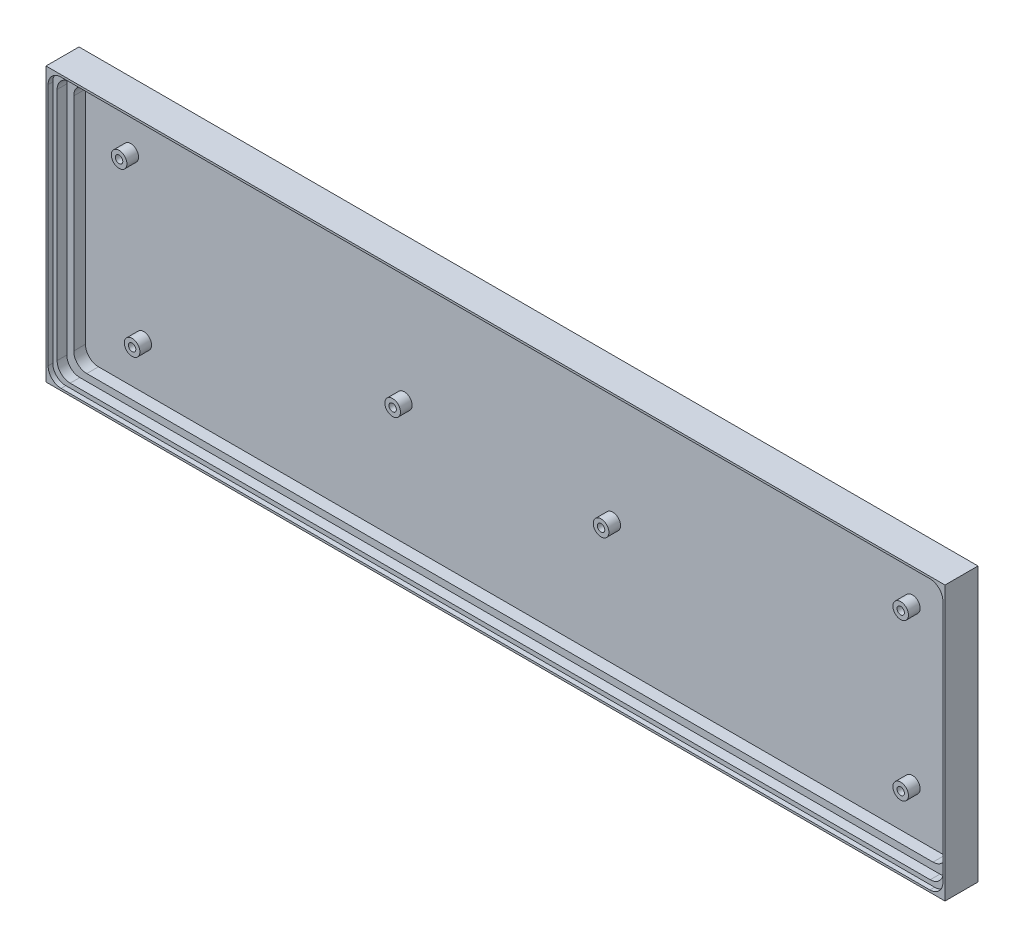
from build123d import *

# Parameters (mm, degrees)
SKETCH1_W           = 328.676
SKETCH1_H           = 100.076
SKETCH1_W_2         = 327.152
SKETCH1_H_2         = 98.552
SKETCH1_W_3         = 323.977
SKETCH1_H_3         = 95.377
SKETCH1_W_4         = 318.897
SKETCH1_H_4         = 90.297
BOSS_EXTRUDE1_DEPTH = 2.54
SKETCH1_3_W         = 328.676
SKETCH1_3_H         = 100.076
SKETCH1_3_W_2       = 327.152
SKETCH1_3_H_2       = 98.552
BOSS_EXTRUDE2_DEPTH = 12.065
SKETCH1_4_W         = 327.152
SKETCH1_4_H         = 98.552
SKETCH1_4_W_2       = 323.977
SKETCH1_4_H_2       = 95.377
BOSS_EXTRUDE3_DEPTH = 10.3505
SKETCH1_5_W         = 323.977
SKETCH1_5_H         = 95.377
SKETCH1_5_W_2       = 318.897
SKETCH1_5_H_2       = 90.297
BOSS_EXTRUDE4_DEPTH = 6.8072
FILLET1_R           = 4.7625
SKETCH2_R           = 2.8575
SKETCH2_R_2         = 1.35255
BOSS_EXTRUDE5_DEPTH = 4.2672


with BuildPart() as part:
    # Sketch1 → Boss-Extrude1 (new body)
    # profile 1 of 4: a face of its own
    with BuildSketch(Plane.XY):
        Rectangle(SKETCH1_W, SKETCH1_H)
        Rectangle(SKETCH1_W_2, SKETCH1_H_2, mode=Mode.SUBTRACT)
    # profile 2 of 4: a face of its own
    with BuildSketch(Plane.XY):
        Rectangle(SKETCH1_W_2, SKETCH1_H_2)
        Rectangle(SKETCH1_W_3, SKETCH1_H_3, mode=Mode.SUBTRACT)
    # profile 3 of 4: a face of its own
    with BuildSketch(Plane.XY):
        Rectangle(SKETCH1_W_3, SKETCH1_H_3)
    # profile 4 of 4: a face of its own
    with BuildSketch(Plane.XY):
        Rectangle(SKETCH1_W_4, SKETCH1_H_4)
    extrude(amount=BOSS_EXTRUDE1_DEPTH)

    # Sketch1<3> → Boss-Extrude2 (add)
    with BuildSketch(Plane.XY):
        Rectangle(SKETCH1_3_W, SKETCH1_3_H)
        Rectangle(SKETCH1_3_W_2, SKETCH1_3_H_2, mode=Mode.SUBTRACT)
    extrude(amount=BOSS_EXTRUDE2_DEPTH)

    # Sketch1<4> → Boss-Extrude3 (add)
    with BuildSketch(Plane.XY):
        Rectangle(SKETCH1_4_W, SKETCH1_4_H)
        Rectangle(SKETCH1_4_W_2, SKETCH1_4_H_2, mode=Mode.SUBTRACT)
    extrude(amount=BOSS_EXTRUDE3_DEPTH)

    # Sketch1<5> → Boss-Extrude4 (add)
    with BuildSketch(Plane.XY):
        Rectangle(SKETCH1_5_W, SKETCH1_5_H)
        Rectangle(SKETCH1_5_W_2, SKETCH1_5_H_2, mode=Mode.SUBTRACT)
    extrude(amount=BOSS_EXTRUDE4_DEPTH)

    # Fillet1
    fillet1_edges = [part.edges().sort_by_distance(p)[0] for p in [
        (159.4485, 45.1485, 4.6736),
        (159.4485, -45.1485, 4.6736),
        (-159.4485, -45.1485, 4.6736),
        (-159.4485, 45.1485, 4.6736),
        (163.576, -49.276, 11.20775),
        (-163.576, -49.276, 11.20775),
        (-163.576, 49.276, 11.20775),
        (163.576, 49.276, 11.20775),
        (161.9885, 47.6885, 8.57885),
        (-161.9885, 47.6885, 8.57885),
        (-161.9885, -47.6885, 8.57885),
        (161.9885, -47.6885, 8.57885),
    ]]
    fillet(fillet1_edges, radius=FILLET1_R)

    # Sketch2 → Boss-Extrude5 (add)
    # profile 1 of 6: a face of its own
    with BuildSketch(Plane.XY.offset(2.54)):
        with Locations((142.875, -28.575)):
            Circle(SKETCH2_R)
        with Locations((142.875, -28.575)):
            Circle(SKETCH2_R_2, mode=Mode.SUBTRACT)
    # profile 2 of 6: a face of its own
    with BuildSketch(Plane.XY.offset(2.54)):
        with Locations((142.875, 28.575)):
            Circle(SKETCH2_R)
        with Locations((142.875, 28.575)):
            Circle(SKETCH2_R_2, mode=Mode.SUBTRACT)
    # profile 3 of 6: a face of its own
    with BuildSketch(Plane.XY.offset(2.54)):
        with Locations((-42.8625, 0)):
            Circle(SKETCH2_R)
        with Locations((-42.8625, 0)):
            Circle(SKETCH2_R_2, mode=Mode.SUBTRACT)
    # profile 4 of 6: a face of its own
    with BuildSketch(Plane.XY.offset(2.54)):
        with Locations((33.3375, 0)):
            Circle(SKETCH2_R)
        with Locations((33.3375, 0)):
            Circle(SKETCH2_R_2, mode=Mode.SUBTRACT)
    # profile 5 of 6: a face of its own
    with BuildSketch(Plane.XY.offset(2.54)):
        with Locations((-142.875, 28.575)):
            Circle(SKETCH2_R)
        with Locations((-142.875, 28.575)):
            Circle(SKETCH2_R_2, mode=Mode.SUBTRACT)
    # profile 6 of 6: a face of its own
    with BuildSketch(Plane.XY.offset(2.54)):
        with Locations((-138.1125, -28.575)):
            Circle(SKETCH2_R)
        with Locations((-138.1125, -28.575)):
            Circle(SKETCH2_R_2, mode=Mode.SUBTRACT)
    extrude(amount=BOSS_EXTRUDE5_DEPTH)


solid = part.part
